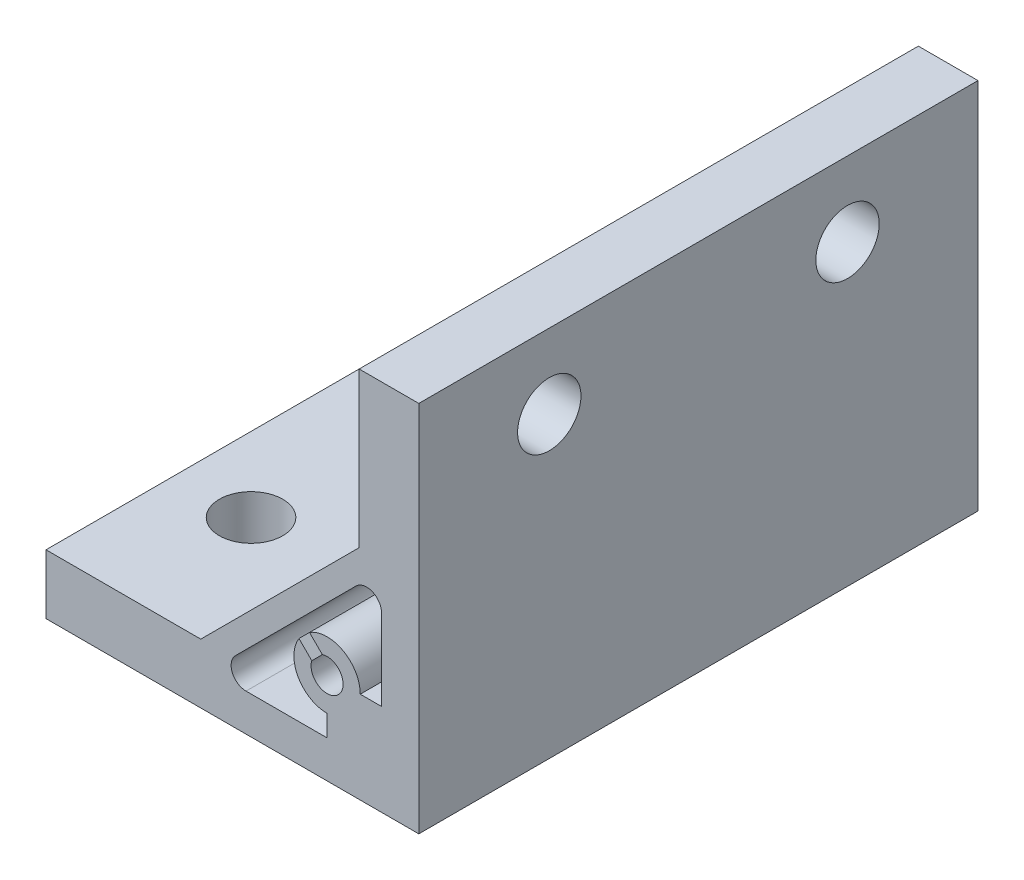
from build123d import *

# Parameters (mm, degrees)
EXTRUDE_1_DEPTH     = 37.5
SKETCH_3_R          = 4.25
CUT_EXTRUDE_1_DEPTH = 76.30106241


with BuildPart() as part:
    # 草图1 → 凸台-拉伸1 (new, symmetric)
    with BuildSketch(Plane.XY):
        Polygon((0, 0), (50, 0), (50, 50), (42, 50), (42, 29.242640687), (20.757359313, 8), (0, 8), align=None)
        with BuildLine():
            Line((37.061279898, 14.352933665), (35.340960992, 16.07325257))
            ThreePointArc((35.340960992, 16.07325257), (39.856939547, 16.192314452), (42.15, 12.3))
            Line((42.15, 12.3), (45, 12.3))
            Line((45, 12.3), (45, 23.171572875))
            ThreePointArc((45, 23.171572875), (43.765366865, 25.01933194), (41.585786438, 24.585786438))
            Line((41.585786438, 24.585786438), (25.414213562, 8.414213562))
            ThreePointArc((25.414213562, 8.414213562), (24.98066806, 6.234633135), (26.828427125, 5))
            Line((26.828427125, 5), (37.7, 5))
            Line((37.7, 5), (37.7, 7.85))
            ThreePointArc((37.7, 7.85), (33.807685548, 10.143060453), (33.92674743, 14.659039008))
            Line((33.92674743, 14.659039008), (35.647066335, 12.938720102))
            ThreePointArc((35.647066335, 12.938720102), (39.22027958, 10.77972042), (37.061279898, 14.352933665))
        make_face(mode=Mode.SUBTRACT)
    extrude(amount=EXTRUDE_1_DEPTH, both=True)

    # 草图3 → 切除-拉伸1 (cut, through all)
    with BuildSketch(Plane(origin=(0, 8, 0), x_dir=(1, 0, 0), z_dir=(0, 1, 0))):
        with Locations(Location((10, 20, 0), (0, 0, 270))):
            Circle(SKETCH_3_R)
        with Locations(Location((10, -20, 0), (0, 0, 90))):
            Circle(SKETCH_3_R)
    cut_extrude_1 = extrude(amount=-CUT_EXTRUDE_1_DEPTH, mode=Mode.SUBTRACT)

    # 镜向1: 切除-拉伸1 across plane
    add(cut_extrude_1.mirror(Plane(origin=(25, 25, 0), x_dir=(0, 0, 1), z_dir=(0.7071067811865487, 0.7071067811865464, 0))), mode=Mode.SUBTRACT)


solid = part.part
